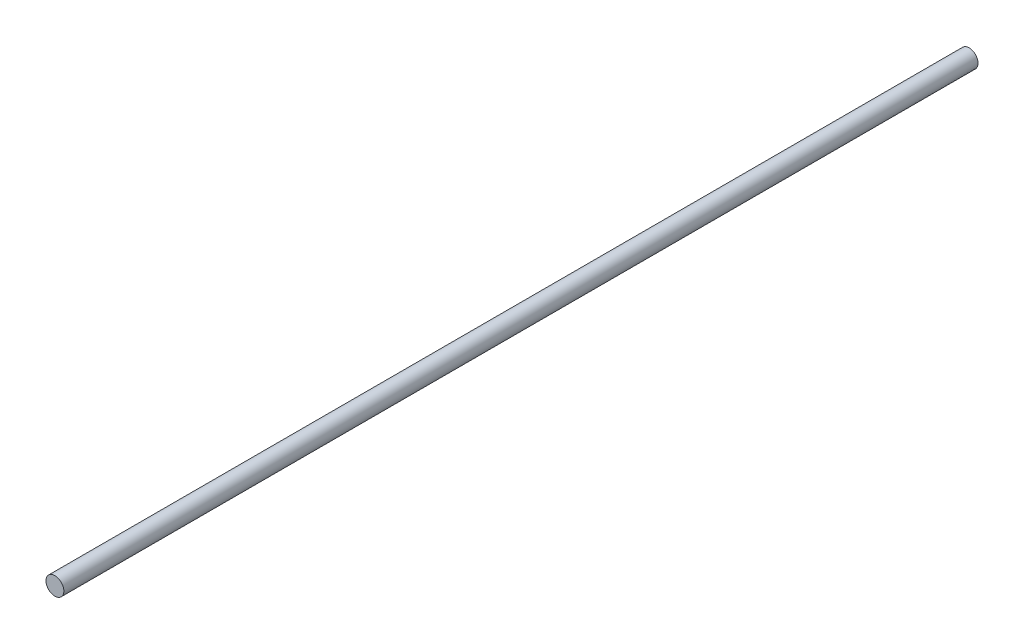
from build123d import *

# Parameters (mm, degrees)
SKETCH1_R           = 6
BOSS_EXTRUDE1_DEPTH = 615


with BuildPart() as part:
    # Sketch1 → Boss-Extrude1 (new body)
    with BuildSketch(Plane.XY):
        Circle(SKETCH1_R)
    extrude(amount=-BOSS_EXTRUDE1_DEPTH)


solid = part.part
